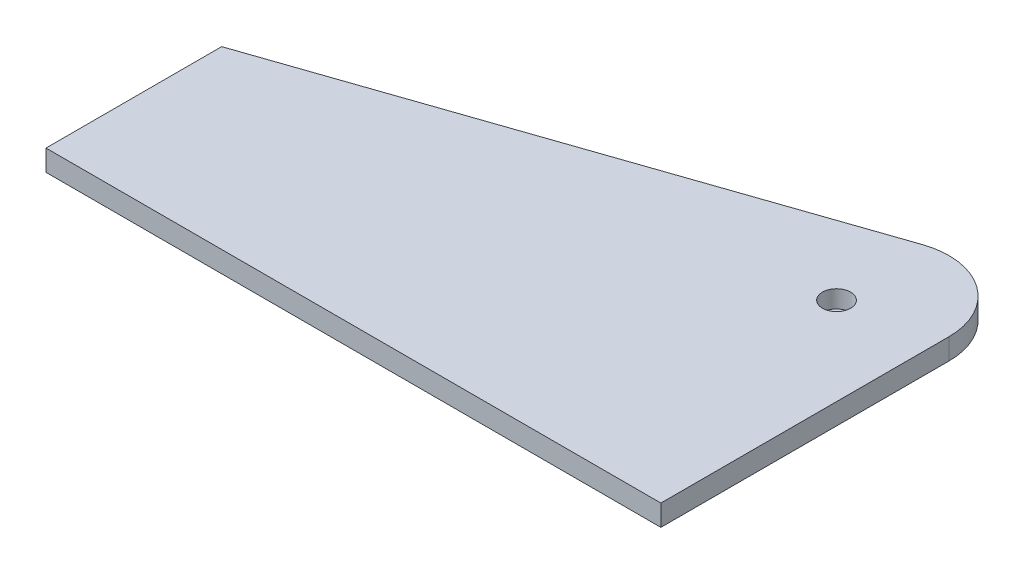
from build123d import *

# Parameters (mm, degrees)
BOSS_EXTRUDE1_DEPTH = 6
FILLET2_R           = 20
SKETCH7_R           = 4
CUT_EXTRUDE3_DEPTH  = 5


with BuildPart() as part:
    # Sketch4 → Boss-Extrude1 (new body)
    with BuildSketch(Plane(origin=(0, 0, 0), x_dir=(1, 0, 0), z_dir=(0, 1, 0))):
        Polygon((-87.5, -50), (87.5, -50), (87.5, 0), (87.5, 60.006143386), (-87.5, 0), align=None)
    extrude(amount=BOSS_EXTRUDE1_DEPTH)

    # Fillet2
    fillet2_edges = [part.edges().sort_by_distance(p)[0] for p in [
        (87.5, 3, -60.006143386),
    ]]
    fillet(fillet2_edges, radius=FILLET2_R)

    # Sketch7 → Cut-Extrude3 (cut)
    with BuildSketch(Plane(origin=(0, 6, 0), x_dir=(1, 0, 0), z_dir=(0, 1, 0))):
        with Locations(Location((62.5, 25, 0), (0, 0, 270))):
            Circle(SKETCH7_R)
    extrude(amount=-CUT_EXTRUDE3_DEPTH, mode=Mode.SUBTRACT)


solid = part.part
